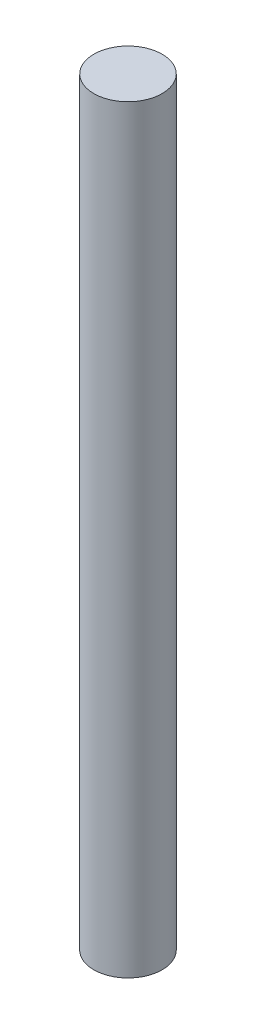
from build123d import *

# Parameters (mm, degrees)
SKETCH1_R           = 4.5
BOSS_EXTRUDE1_DEPTH = 100


with BuildPart() as part:
    # Sketch1 → Boss-Extrude1 (new body)
    with BuildSketch(Plane(origin=(0, 0, 0), x_dir=(1, 0, 0), z_dir=(0, 1, 0))):
        with Locations(Location((0, 0, 0), (0, 0, 270))):
            Circle(SKETCH1_R)
    extrude(amount=BOSS_EXTRUDE1_DEPTH)


solid = part.part
